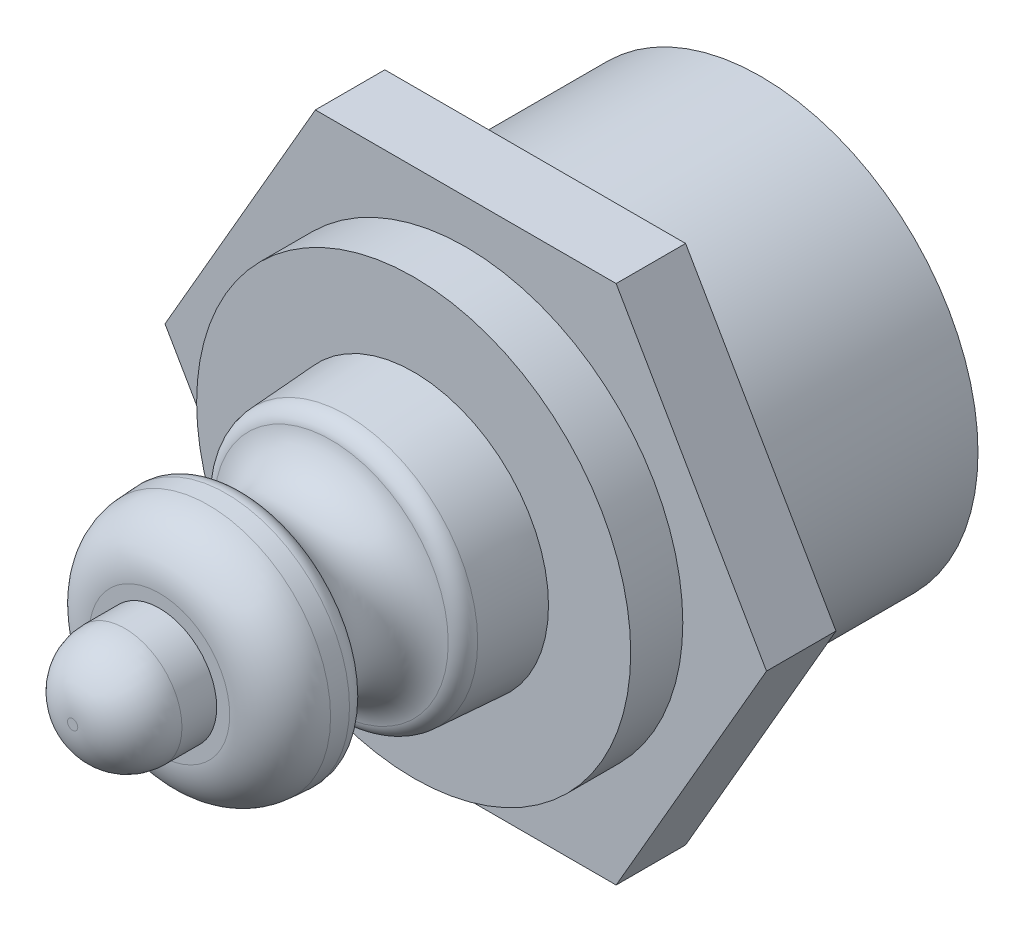
from build123d import *

# Parameters (mm, degrees)
SKETCH1_R      = 7.9375
EXTRUDE1_DEPTH = 12.7
EXTRUDE2_DEPTH = 2.54
FILLET1_R      = 1.905
SKETCH5_R      = 2.092407527
EXTRUDE3_DEPTH = 3.175
FILLET2_R      = 1.905
FILLET3_R      = 0.635


with BuildPart() as part:
    # Sketch1 → Extrude1 (new body)
    with BuildSketch(Plane.XY):
        Circle(SKETCH1_R)
    extrude(amount=EXTRUDE1_DEPTH)

    # Sketch2 → Extrude2 (add)
    with BuildSketch(Plane.XY.offset(10.795)):
        Polygon((5.499261314, 9.525), (-5.499261314, 9.525), (-10.998522628, 0), (-5.499261314, -9.525), (5.499261314, -9.525), (10.998522628, 0), align=None)
    extrude(amount=-EXTRUDE2_DEPTH)

    # Sketch4 → Revolve1 (revolve)
    with BuildSketch(Plane(origin=(0, 0, 0), x_dir=(1, 0, 0), z_dir=(0, 1, 0))):
        with BuildLine():
            Line((-4.931059874, -12.7), (-4.747984705, -15.684208349))
            ThreePointArc((-4.747984705, -15.684208349), (-2.982016662, -17.246023592), (-4.543831906, -19.011991635))
            Line((-4.543831906, -19.011991635), (-4.360756736, -21.996199983))
            Line((-4.360756736, -21.996199983), (0, -21.996199983))
            Line((0, -21.996199983), (0, -12.7))
            Line((0, -12.7), (-4.931059874, -12.7))
        make_face()
    revolve(axis=Axis((0, 0, 12.7), (0, 0, 1)))

    # Fillet1
    fillet1_edges = [part.edges().sort_by_distance(p)[0] for p in [
        (4.360756736, 0, 21.996199983),
    ]]
    fillet(fillet1_edges, radius=FILLET1_R)

    # Sketch5 → Extrude3 (add)
    with BuildSketch(Plane.XY.offset(21.996199983)):
        Circle(SKETCH5_R)
    extrude(amount=EXTRUDE3_DEPTH)

    # Fillet2
    fillet2_edges = [part.edges().sort_by_distance(p)[0] for p in [
        (-2.092407527, 0, 25.171199983),
    ]]
    fillet(fillet2_edges, radius=FILLET2_R)

    # Fillet3
    fillet3_edges = [part.edges().sort_by_distance(p)[0] for p in [
        (4.747984705, 0, 15.684208349),
        (4.543831906, 0, 19.011991635),
    ]]
    fillet(fillet3_edges, radius=FILLET3_R)


solid = part.part
